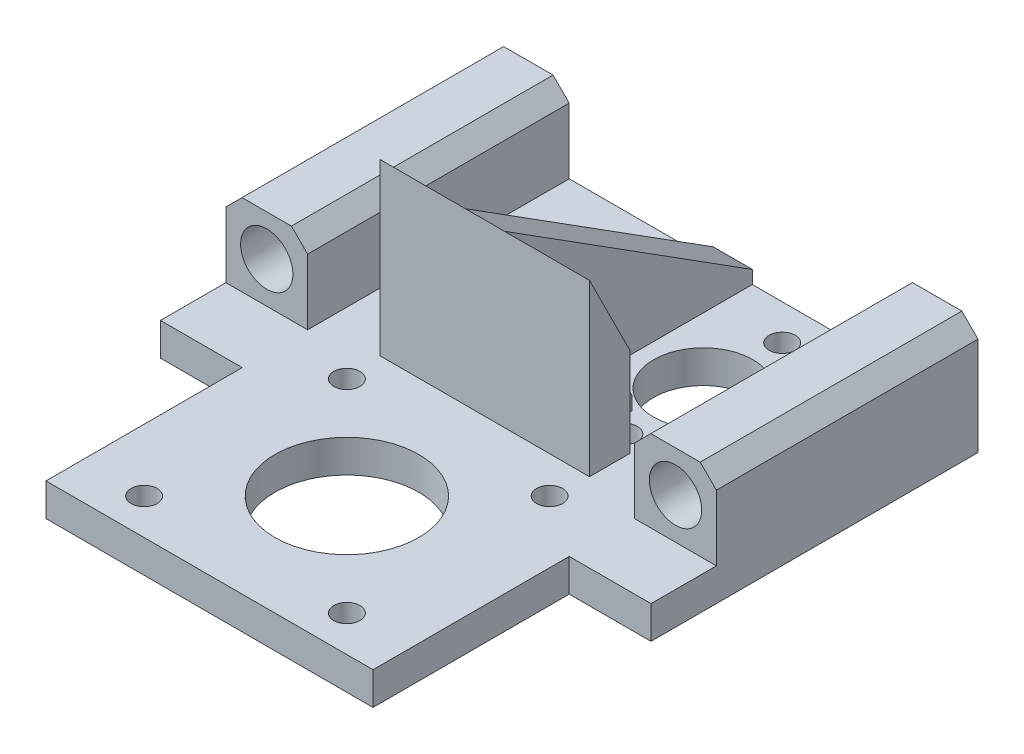
from build123d import *

# Parameters (mm, degrees)
SKETCH1_W               = 75
SKETCH1_H               = 50
SKETCH1_R               = 5.1
SKETCH1_R_2             = 7.6
BOSS_EXTRUDE1_DEPTH     = 5
SKETCH2_W               = 12.5
SKETCH2_H               = 40
BOSS_EXTRUDE2_DEPTH     = 12.5
SKETCH3_R               = 4
CUT_EXTRUDE1_DEPTH      = 92.821838361
SKETCH4_W               = 50
SKETCH4_H               = 30
BOSS_EXTRUDE3_DEPTH     = 5
SKETCH5_R               = 2
SKETCH5_R_2             = 11
CUT_EXTRUDE2_DEPTH      = 92.001373616
SKETCH6_W               = 32
SKETCH6_H               = 12
BOSS_EXTRUDE4_DEPTH     = 2
BOSS_EXTRUDE6_DEPTH     = 32
SKETCH9_W               = 6
SKETCH9_H               = 25.9
BOSS_EXTRUDE7_DEPTH     = 2
BOSS_EXTRUDE8_DEPTH     = 6
CUT_EXTRUDE3_DEPTH      = 97.571217244
CUT_EXTRUDE3_DEPTH_BACK = 97.571217244
SKETCH11_R              = 2
SKETCH11_R_2            = 1.5
SKETCH13_R              = 3.7
SKETCH13_R_2            = 2.75
SKETCH13_W              = 5.5
SKETCH13_H              = 1.674207078
CUT_EXTRUDE4_DEPTH      = 94.813645063


with BuildPart() as part:
    # Sketch1 → Boss-Extrude1 (new body)
    with BuildSketch(Plane(origin=(0, 0, 0), x_dir=(1, 0, 0), z_dir=(0, 1, 0))):
        with Locations((37.5, 25)):
            Rectangle(SKETCH1_W, SKETCH1_H)
        with Locations(Location((24.5, 32.5, 0), (0, 0, 270))):
            Circle(SKETCH1_R, mode=Mode.SUBTRACT)
        with Locations(Location((50.5, 32.5, 0), (0, 0, 270))):
            Circle(SKETCH1_R_2, mode=Mode.SUBTRACT)
    extrude(amount=BOSS_EXTRUDE1_DEPTH)

    # Sketch2 → Boss-Extrude2 (add)
    with BuildSketch(Plane(origin=(0, 5, 0), x_dir=(1, 0, 0), z_dir=(0, 1, 0))):
        with Locations((6.25, 30)):
            Rectangle(SKETCH2_W, SKETCH2_H)
        with Locations((68.75, 30)):
            Rectangle(SKETCH2_W, SKETCH2_H)
    extrude(amount=BOSS_EXTRUDE2_DEPTH)

    # Sketch3 → Cut-Extrude1 (cut, through all)
    with BuildSketch(Plane(origin=(0, 0, -50), x_dir=(-1, 0, 0), z_dir=(0, 0, -1))):
        with Locations((-68.75, 11.25)):
            Circle(SKETCH3_R)
        with Locations((-6.25, 11.25)):
            Circle(SKETCH3_R)
        Polygon((-72.525126266, 17.5), (-75, 17.5), (-75, 15.025126266), align=None)
        Polygon((-62.5, 17.5), (-64.974873734, 17.5), (-62.5, 15.025126266), align=None)
        Polygon((-12.5, 15.025126266), (-12.5, 17.5), (-10.025126266, 17.5), align=None)
        Polygon((0, 15.025126266), (-2.474873734, 17.5), (0, 17.5), align=None)
    extrude(amount=-CUT_EXTRUDE1_DEPTH, mode=Mode.SUBTRACT)

    # Sketch4 → Boss-Extrude3 (add)
    with BuildSketch(Plane(origin=(0, 5, 0), x_dir=(1, 0, 0), z_dir=(0, 1, 0))):
        with Locations((37.5, -15)):
            Rectangle(SKETCH4_W, SKETCH4_H)
    extrude(amount=-BOSS_EXTRUDE3_DEPTH)

    # Sketch5 → Cut-Extrude2 (cut, through all)
    with BuildSketch(Plane(origin=(0, 5, 0), x_dir=(1, 0, 0), z_dir=(0, 1, 0))):
        with Locations(Location((22, -24.5, 0), (0, 0, 270))):
            Circle(SKETCH5_R)
        with Locations(Location((22, 6.5, 0), (0, 0, 90))):
            Circle(SKETCH5_R)
        with Locations(Location((53, 6.5, 0), (0, 0, 270))):
            Circle(SKETCH5_R)
        with Locations(Location((53, -24.5, 0), (0, 0, 90))):
            Circle(SKETCH5_R)
        with Locations(Location((37.5, -9, 0), (0, 0, 270))):
            Circle(SKETCH5_R_2)
    extrude(amount=-CUT_EXTRUDE2_DEPTH, mode=Mode.SUBTRACT)

    # Sketch6 → Boss-Extrude4 (add)
    with BuildSketch(Plane(origin=(0, 5, 0), x_dir=(1, 0, 0), z_dir=(0, 1, 0))):
        with Locations((37.5, 18.1)):
            Rectangle(SKETCH6_W, SKETCH6_H)
    extrude(amount=BOSS_EXTRUDE4_DEPTH)

    # Sketch8 → Boss-Extrude6 (add)
    with BuildSketch(Plane(origin=(53.5, 0, 0), x_dir=(0, 0, -1), z_dir=(1, 0, 0))):
        Polygon((24.1, 7), (12.1, 7), (12.1, 31), align=None)
    extrude(amount=-BOSS_EXTRUDE6_DEPTH)

    # Sketch9 → Boss-Extrude7 (add)
    with BuildSketch(Plane(origin=(0, 5, 0), x_dir=(1, 0, 0), z_dir=(0, 1, 0))):
        with Locations((37.5, 37.05)):
            Rectangle(SKETCH9_W, SKETCH9_H)
    extrude(amount=BOSS_EXTRUDE7_DEPTH)

    # Sketch10 → Boss-Extrude8 (add)
    with BuildSketch(Plane.ZY.offset(-34.5)):
        Polygon((-50, 7), (-12.1, 31), (-24.1, 7), align=None)
    extrude(amount=-BOSS_EXTRUDE8_DEPTH)

    # Sketch11 → Cut-Extrude3 (cut, two sides: drawn at the far end of the back side and taken through both)
    with BuildSketch(Plane(origin=(0, 5, 5), x_dir=(1, 0, 0), z_dir=(0, 1, 0)).offset(-CUT_EXTRUDE3_DEPTH_BACK)):
        with Locations(Location((50.5, 25.43, 0), (0, 0, 270))):
            Circle(SKETCH11_R)
        with Locations(Location((50.5, 49.565, 0), (0, 0, 270))):
            Circle(SKETCH11_R)
        with Locations(Location((24.5, 45.5, 0), (0, 0, 270))):
            Circle(SKETCH11_R_2)
        with Locations(Location((16.5, 37.5, 0), (0, 0, 270))):
            Circle(SKETCH11_R_2)
        with Locations(Location((32.5, 37.5, 0), (0, 0, 90))):
            Circle(SKETCH11_R_2)
        with Locations(Location((24.5, 29.5, 0), (0, 0, 195.466009953))):
            Circle(SKETCH11_R_2)
    extrude(amount=CUT_EXTRUDE3_DEPTH + CUT_EXTRUDE3_DEPTH_BACK, mode=Mode.SUBTRACT)

    # Sketch13 → Cut-Extrude4 (cut, through all)
    with BuildSketch(Plane(origin=(0, 5, 0), x_dir=(1, 0, 0), z_dir=(0, 1, 0))):
        with Locations((50.5, 20.43)):
            Circle(SKETCH13_R)
        with Locations((24.5, 24.5)):
            Circle(SKETCH13_R_2)
        with Locations((50.75, 23.262896461)):
            Rectangle(SKETCH13_W, SKETCH13_H)
    extrude(amount=CUT_EXTRUDE4_DEPTH, mode=Mode.SUBTRACT)


solid = part.part
